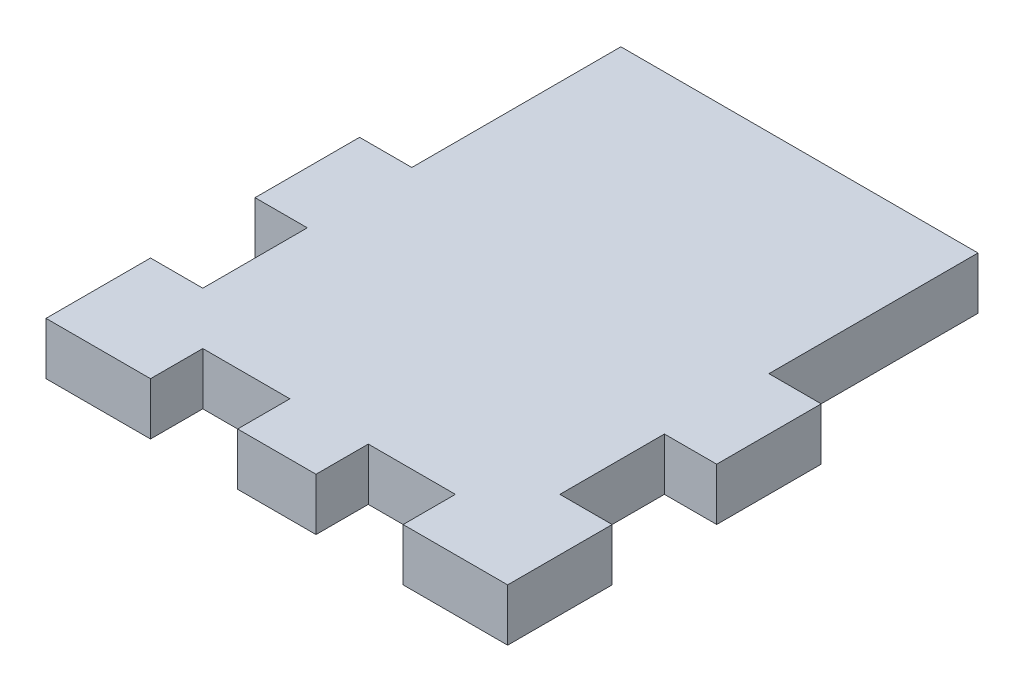
from build123d import *

# Parameters (mm, degrees)
PAREDELADO2_DEPTH = 3


with BuildPart() as part:
    # ParedeLado2Esboco → ParedeLado2 (new body)
    with BuildSketch(Plane(origin=(0, 0, 0), x_dir=(1, 0, 0), z_dir=(0, 1, 0))):
        Polygon((0, 0), (0, 6), (3, 6), (3, 12), (0, 12), (0, 18), (3, 18), (3, 30), (23.5, 30), (23.5, 18), (26.5, 18), (26.5, 12), (23.5, 12), (23.5, 6), (26.5, 6), (26.5, 0), (20.5, 0), (20.5, 3), (15.5, 3), (15.5, 0), (11, 0), (11, 3), (6, 3), (6, 0), align=None)
    extrude(amount=PAREDELADO2_DEPTH)


solid = part.part
